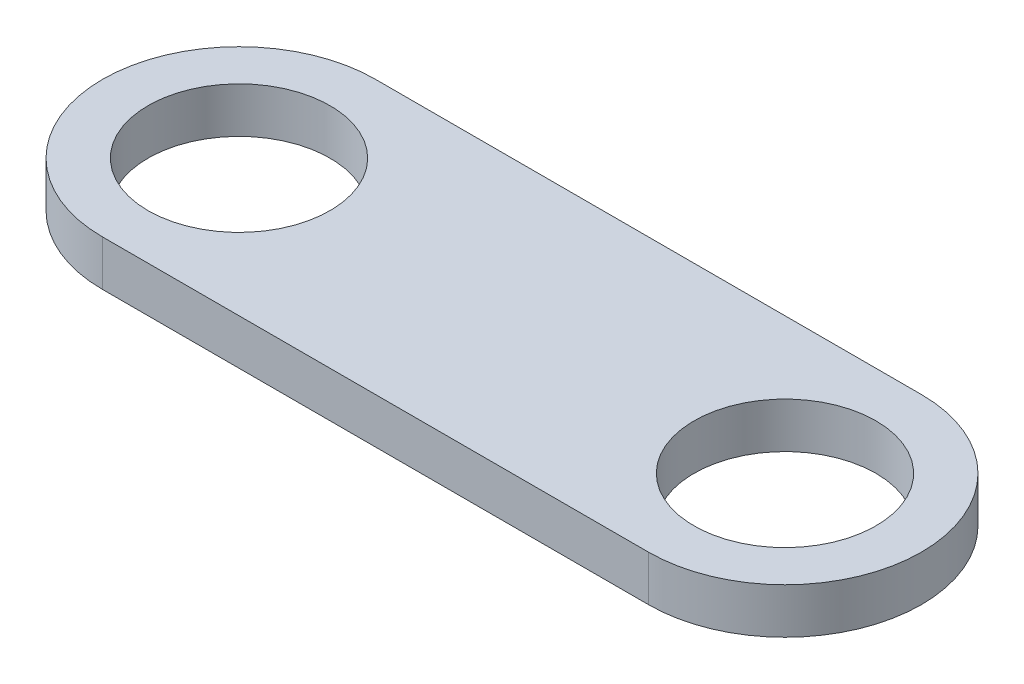
from build123d import *

# Parameters (mm, degrees)
SKETCH1_R           = 1
BOSS_EXTRUDE1_DEPTH = 0.5


with BuildPart() as part:
    # Sketch1 → Boss-Extrude1 (new body)
    with BuildSketch(Plane(origin=(0, 0, 0), x_dir=(1, 0, 0), z_dir=(0, 1, 0))):
        with BuildLine():
            Line((-3, 1.5), (3, 1.5))
            ThreePointArc((3, 1.5), (4.5, 0), (3, -1.5))
            Line((3, -1.5), (-3, -1.5))
            ThreePointArc((-3, -1.5), (-4.5, 0), (-3, 1.5))
        make_face()
        with Locations(Location((-3, 0, 0), (0, 0, 270))):
            Circle(SKETCH1_R, mode=Mode.SUBTRACT)
        with Locations(Location((3, 0, 0), (0, 0, 90))):
            Circle(SKETCH1_R, mode=Mode.SUBTRACT)
    extrude(amount=BOSS_EXTRUDE1_DEPTH)


solid = part.part
